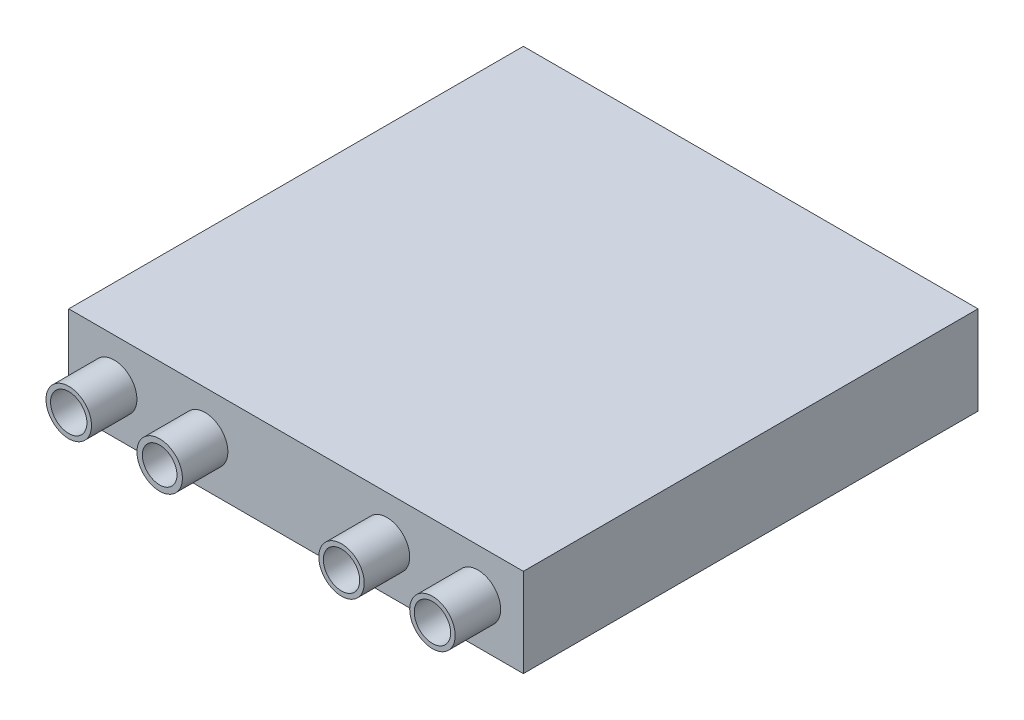
from build123d import *

# Parameters (mm, degrees)
SKETCH1_W           = 1000
SKETCH1_H           = 195
BOSS_EXTRUDE1_DEPTH = 1000
SKETCH2_R           = 50
SKETCH2_R_2         = 40
SKETCH2_R_3         = 38.049771674
BOSS_EXTRUDE2_DEPTH = 100
CUT_EXTRUDE1_START  = -964
SKETCH5_R           = 40
SKETCH5_R_2         = 38.049771674
CUT_EXTRUDE1_DEPTH  = 964


with BuildPart() as part:
    # Sketch1 → Boss-Extrude1 (new body)
    with BuildSketch(Plane.XY):
        with Locations((500, -97.5)):
            Rectangle(SKETCH1_W, SKETCH1_H)
    extrude(amount=BOSS_EXTRUDE1_DEPTH)

    # Sketch2 → Boss-Extrude2 (add)
    # profile 1 of 4: a face of its own
    with BuildSketch(Plane.XY.offset(1000)):
        with Locations(Location((100, -97.5, 0), (0, 0, 180))):
            Circle(SKETCH2_R)
        with Locations((100, -97.5)):
            Circle(SKETCH2_R_2, mode=Mode.SUBTRACT)
    # profile 2 of 4: a face of its own
    with BuildSketch(Plane.XY.offset(1000)):
        with Locations(Location((300, -97.5, 0), (0, 0, 180))):
            Circle(SKETCH2_R)
        with Locations((300, -97.5)):
            Circle(SKETCH2_R_3, mode=Mode.SUBTRACT)
    # profile 3 of 4: a face of its own
    with BuildSketch(Plane.XY.offset(1000)):
        with Locations(Location((700, -97.5, 0), (0, 0, 180))):
            Circle(SKETCH2_R)
        with Locations((700, -97.5)):
            Circle(SKETCH2_R_2, mode=Mode.SUBTRACT)
    # profile 4 of 4: a face of its own
    with BuildSketch(Plane.XY.offset(1000)):
        with Locations(Location((900, -97.5, 0), (0, 0, 180))):
            Circle(SKETCH2_R)
        with Locations((900, -97.5)):
            Circle(SKETCH2_R_2, mode=Mode.SUBTRACT)
    extrude(amount=BOSS_EXTRUDE2_DEPTH)

    # Sketch5 → Cut-Extrude1 (cut)
    with BuildSketch(Plane.XY.offset(1000).offset(CUT_EXTRUDE1_START)):
        with Locations((100, -97.5)):
            Circle(SKETCH5_R)
        with Locations((300, -97.5)):
            Circle(SKETCH5_R_2)
        with Locations((700, -97.5)):
            Circle(SKETCH5_R)
        with Locations((900, -97.5)):
            Circle(SKETCH5_R)
    extrude(amount=CUT_EXTRUDE1_DEPTH, mode=Mode.SUBTRACT)


solid = part.part
